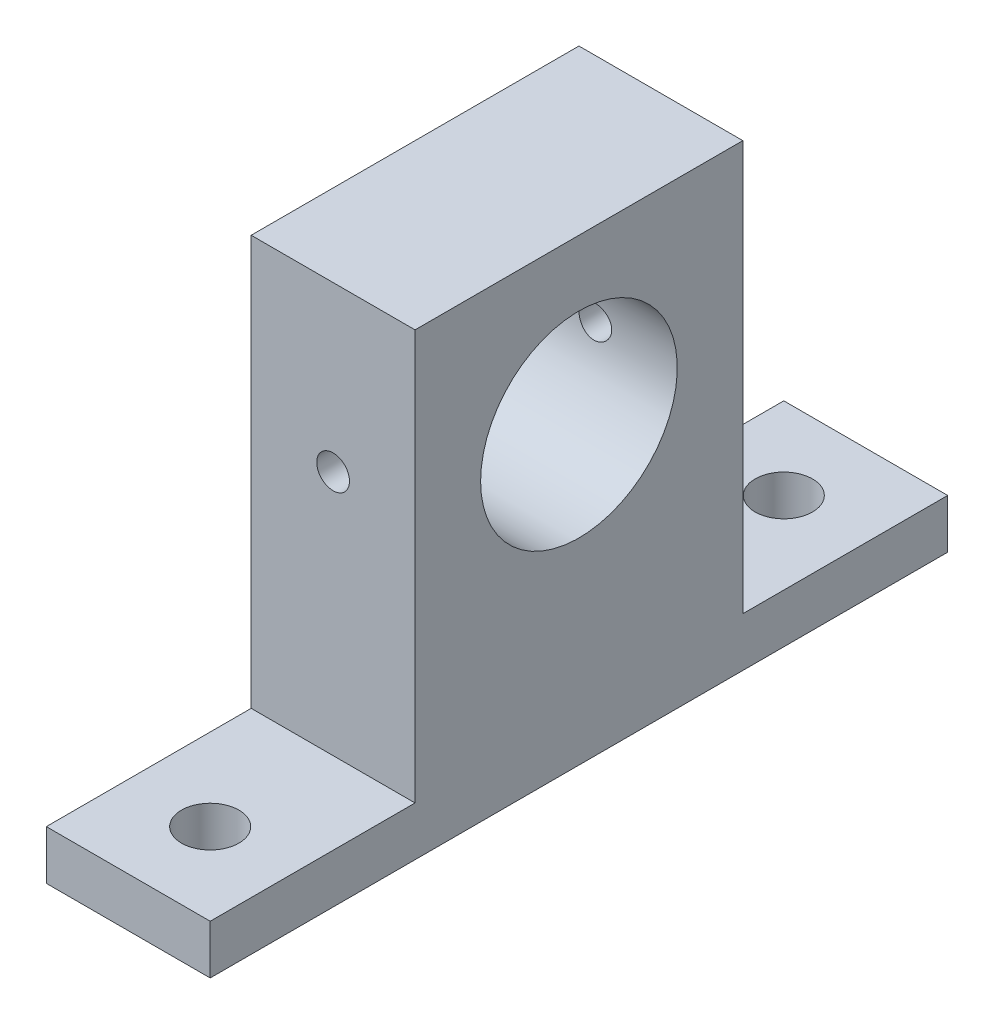
from build123d import *

# Parameters (mm, degrees)
SKETCH2_W           = 10
SKETCH2_H           = 45
SKETCH2_R           = 1.75
BOSS_EXTRUDE1_DEPTH = 3
SKETCH3_W           = 10
SKETCH3_H           = 20
BOSS_EXTRUDE2_DEPTH = 25
SKETCH4_R           = 6
CUT_EXTRUDE1_DEPTH  = 10
SKETCH5_R           = 1
CUT_EXTRUDE2_DEPTH  = 20


with BuildPart() as part:
    # Sketch2 → Boss-Extrude1 (new body)
    with BuildSketch(Plane(origin=(0, 0, 0), x_dir=(1, 0, 0), z_dir=(0, 1, 0))):
        Rectangle(SKETCH2_W, SKETCH2_H)
        with Locations(Location((0, 17.5, 0), (0, 0, 270))):
            Circle(SKETCH2_R, mode=Mode.SUBTRACT)
        with Locations(Location((0, -17.5, 0), (0, 0, 270))):
            Circle(SKETCH2_R, mode=Mode.SUBTRACT)
    extrude(amount=BOSS_EXTRUDE1_DEPTH)

    # Sketch3 → Boss-Extrude2 (add)
    with BuildSketch(Plane(origin=(0, 3, 0), x_dir=(1, 0, 0), z_dir=(0, 1, 0))):
        Rectangle(SKETCH3_W, SKETCH3_H)
    extrude(amount=BOSS_EXTRUDE2_DEPTH)

    # Sketch4 → Cut-Extrude1 (cut)
    with BuildSketch(Plane.ZY.offset(5)):
        with Locations((0, 18)):
            Circle(SKETCH4_R)
    extrude(amount=-CUT_EXTRUDE1_DEPTH, mode=Mode.SUBTRACT)

    # Sketch5 → Cut-Extrude2 (cut)
    with BuildSketch(Plane.XY.offset(10)):
        with Locations((0, 18)):
            Circle(SKETCH5_R)
    extrude(amount=-CUT_EXTRUDE2_DEPTH, mode=Mode.SUBTRACT)


solid = part.part
